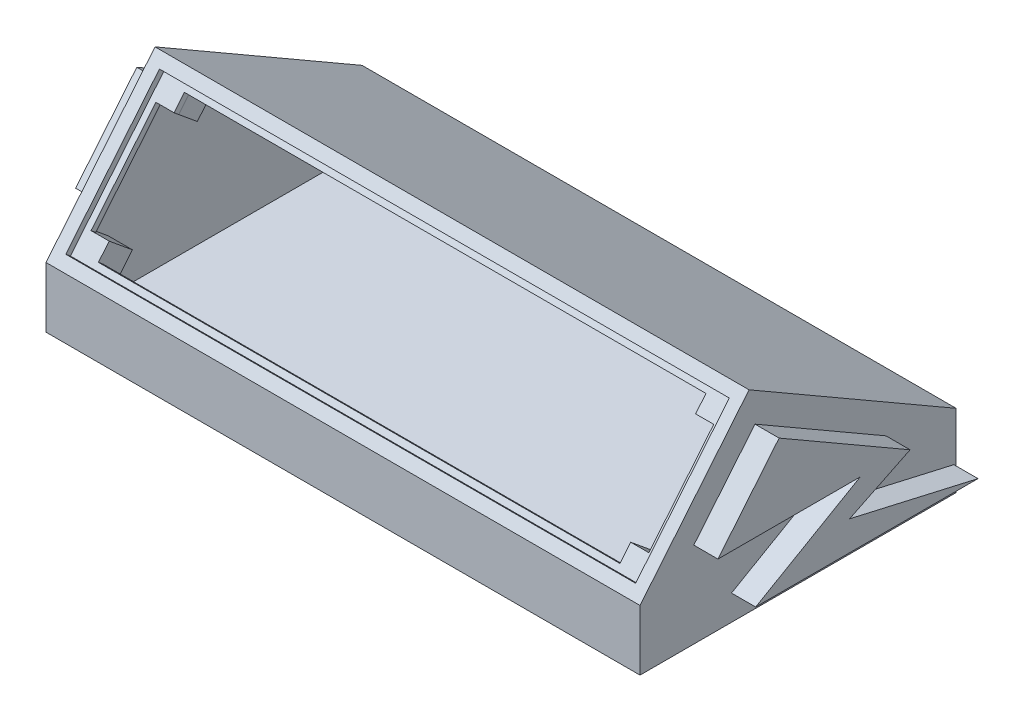
from build123d import *

# Parameters (mm, degrees)
BOSS_EXTRUDE2_DEPTH  = 123
CUT_EXTRUDE2_DEPTH   = 118
SKETCH4_W            = 236
SKETCH4_H            = 60.975887641
CUT_EXTRUDE3_DEPTH   = 2.5
CUT_EXTRUDE4_DEPTH   = 2.5
BOSS_EXTRUDE4_DEPTH  = 10
SKETCH15_W           = 10
SKETCH15_H           = 10
SKETCH15_W_2         = 9
SKETCH15_H_2         = 9
SKETCH15_W_3         = 10.002299771
SKETCH15_W_4         = 9.002299771
BOSS_EXTRUDE14_DEPTH = 10


with BuildPart() as part:
    # Sketch1 → Boss-Extrude2 (new, symmetric)
    with BuildSketch(Plane(origin=(0, 0, 0), x_dir=(0, 0, -1), z_dir=(1, 0, 0))):
        Polygon((42.073890907, 65.041424054), (127.810405881, 15.541424054), (127.810405881, -14.715701058), (-3.083986323, -14.715701058), (-3.083986323, 10.284298942), align=None)
    extrude(amount=BOSS_EXTRUDE2_DEPTH, both=True)

    # Sketch3 → Cut-Extrude2 (cut, symmetric)
    with BuildSketch(Plane(origin=(0, 0, 0), x_dir=(0, 0, -1), z_dir=(1, 0, 0))):
        Polygon((43.238822658, 58.595347702), (1.916013677, 8.488514516), (1.916013677, -9.715701058), (122.810405881, -9.715701058), (122.810405881, 12.654672708), align=None)
    extrude(amount=CUT_EXTRUDE2_DEPTH, both=True, mode=Mode.SUBTRACT)

    # Sketch4 → Cut-Extrude3 (cut)
    with BuildSketch(Plane(origin=(0, 5.676918447, 6.883665768), x_dir=(1, 0, 0), z_dir=(0, 0.6362425146167643, 0.7714891202046446))):
        with Locations((0, 41.460005351)):
            Rectangle(SKETCH4_W, SKETCH4_H)
    extrude(amount=-CUT_EXTRUDE3_DEPTH, mode=Mode.SUBTRACT)

    # Sketch5 → Cut-Extrude4 (cut)
    with BuildSketch(Plane(origin=(0, 4.08631216, 4.954942968), x_dir=(1, 0, 0), z_dir=(0, 0.6362425146167643, 0.7714891202046446))):
        Polygon((107.577700229, 69.447949171), (107.997700229, 69.447949171), (107.997700229, 62.714644326), (115.5, 62.714644326), (115.5, 62.664644326), (115.5, 62.614644326), (115.5, 62.447949171), (115.5, 20.47206153), (107.997700229, 20.47206153), (107.997700229, 13.47206153), (-107.997700229, 13.47206153), (-107.997700229, 20.47206153), (-115.5, 20.47206153), (-115.5, 62.714644326), (-107.997700229, 62.714644326), (-107.997700229, 69.447949171), align=None)
    extrude(amount=-CUT_EXTRUDE4_DEPTH, mode=Mode.SUBTRACT)

    # Sketch6 → Boss-Extrude4 (add)
    with BuildSketch(Plane.ZY.offset(123)):
        Polygon((-73.692184958, 7.957950111), (-98.764682853, 20.186624411), (-44.520247585, 51.504663714), (-19.185344447, 20.784298942), (-78.102547156, 20.784298942), (-34.801276967, -4.215701058), (-126.884199241, -4.215701058), align=None)
    boss_extrude4 = extrude(amount=BOSS_EXTRUDE4_DEPTH)

    # Mirror1: Boss-Extrude4 across plane
    add(boss_extrude4.mirror(Plane(origin=(0, 0, 0), x_dir=(0, 0, 1), z_dir=(1, 0, 0))))

    # Sketch15 → Boss-Extrude14 (add)
    # profile 1 of 4: a face of its own
    with BuildSketch(Plane(origin=(0, 2.495705874, 3.026220167), x_dir=(-1, 0, 0), z_dir=(0, -0.6362425146167643, -0.7714891202046446))):
        with Locations((-113, 67.716050504)):
            Rectangle(SKETCH15_W, SKETCH15_H)
        with Locations((-113, 67.716050504)):
            Rectangle(SKETCH15_W_2, SKETCH15_H_2, mode=Mode.SUBTRACT)
    # profile 2 of 4: a face of its own
    with BuildSketch(Plane(origin=(0, 2.495705874, 3.026220167), x_dir=(-1, 0, 0), z_dir=(0, -0.6362425146167643, -0.7714891202046446))):
        with Locations((113, 67.716050504)):
            Rectangle(SKETCH15_W, SKETCH15_H)
        with Locations((113, 67.716050504)):
            Rectangle(SKETCH15_W_2, SKETCH15_H_2, mode=Mode.SUBTRACT)
    # profile 3 of 4: a face of its own
    with BuildSketch(Plane(origin=(0, 2.495705874, 3.026220167), x_dir=(-1, 0, 0), z_dir=(0, -0.6362425146167643, -0.7714891202046446))):
        with Locations((-112.998850115, 15.47206153)):
            Rectangle(SKETCH15_W_3, SKETCH15_H)
        with Locations((-112.998850115, 15.47206153)):
            Rectangle(SKETCH15_W_4, SKETCH15_H_2, mode=Mode.SUBTRACT)
    # profile 4 of 4: a face of its own
    with BuildSketch(Plane(origin=(0, 2.495705874, 3.026220167), x_dir=(-1, 0, 0), z_dir=(0, -0.6362425146167643, -0.7714891202046446))):
        with Locations((112.998850115, 15.47206153)):
            Rectangle(SKETCH15_W_3, SKETCH15_H)
        with Locations((112.998850115, 15.47206153)):
            Rectangle(SKETCH15_W_4, SKETCH15_H_2, mode=Mode.SUBTRACT)
    extrude(amount=BOSS_EXTRUDE14_DEPTH)


solid = part.part
